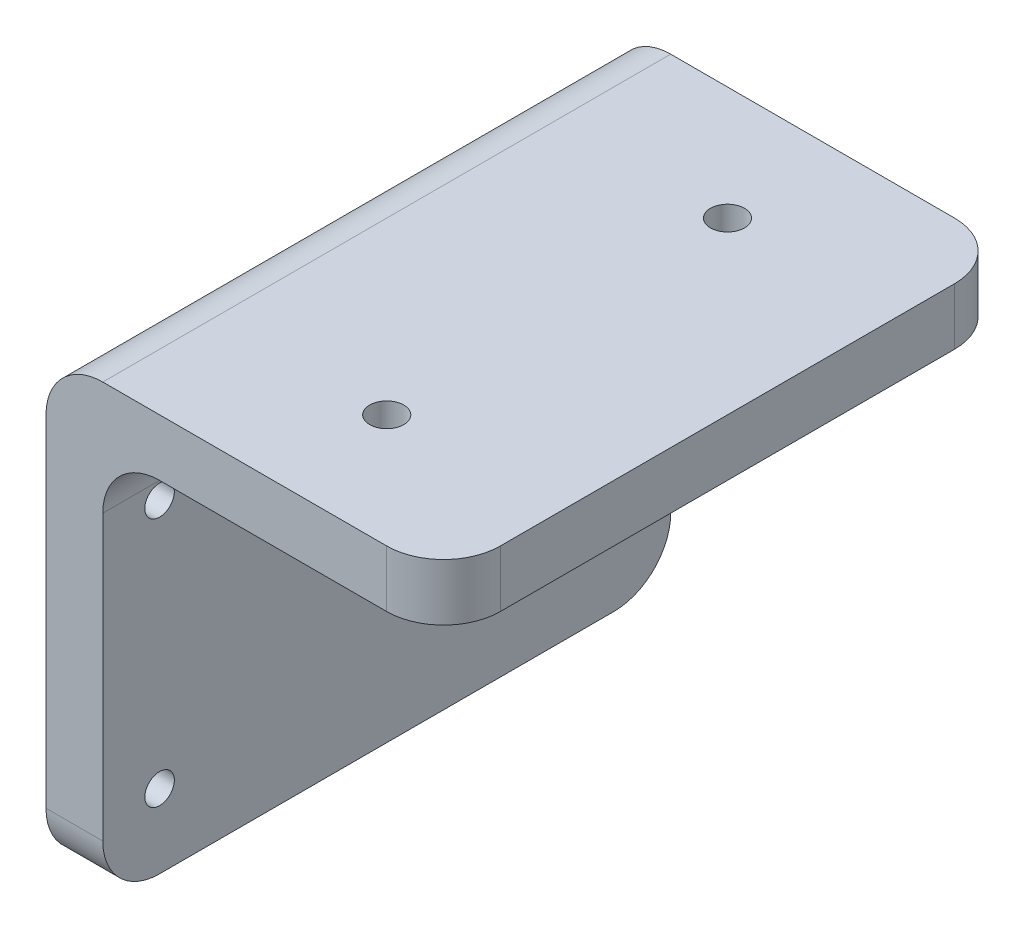
from build123d import *

# Parameters (mm, degrees)
ESQUISSE1_W             = 30
ESQUISSE1_H             = 50
BOSS_EXTRU_1_DEPTH      = 5
ESQUISSE2_W             = 50
ESQUISSE2_H             = 40
BOSS_EXTRU_2_DEPTH      = 5
CONG_2_R                = 5
ESQUISSE11_R            = 1.5
ENL_V_MAT_EXTRU_2_DEPTH = 52.23475383
ESQUISSE12_R            = 10.25
ESQUISSE12_R_2          = 1.3
ENL_V_MAT_EXTRU_3_DEPTH = 59.736700622


with BuildPart() as part:
    # Esquisse1 → Boss.-Extru.1 (new body)
    with BuildSketch(Plane(origin=(0, 0, 0), x_dir=(1, 0, 0), z_dir=(0, 1, 0))):
        Rectangle(ESQUISSE1_W, ESQUISSE1_H)
    extrude(amount=-BOSS_EXTRU_1_DEPTH)

    # Esquisse2 → Boss.-Extru.2 (add)
    with BuildSketch(Plane.ZY.offset(15)):
        with Locations((0, -20)):
            Rectangle(ESQUISSE2_W, ESQUISSE2_H)
    extrude(amount=BOSS_EXTRU_2_DEPTH)

    # Congé2
    cong_2_edges = [part.edges().sort_by_distance(p)[0] for p in [
        (-15, -5, 0),
        (-17.5, -40, 25),
        (-17.5, -40, -25),
        (-20, 0, 0),
        (15, -2.5, 25),
        (15, -2.5, -25),
    ]]
    fillet(cong_2_edges, radius=CONG_2_R)

    # Esquisse11 → Enlèv. mat.-Extru.2 (cut, through all)
    with BuildSketch(Plane(origin=(0, 0, 0), x_dir=(1, 0, 0), z_dir=(0, 1, 0))):
        with Locations(Location((0, 15, 0), (0, 0, 270))):
            Circle(ESQUISSE11_R)
        with Locations(Location((0, -15, 0), (0, 0, 270))):
            Circle(ESQUISSE11_R)
    extrude(amount=-ENL_V_MAT_EXTRU_2_DEPTH, mode=Mode.SUBTRACT)

    # Esquisse12 → Enlèv. mat.-Extru.3 (cut, through all)
    with BuildSketch(Plane.ZY.offset(20)):
        with Locations((-12, -22.5)):
            Circle(ESQUISSE12_R)
        with Locations((-20, -11.5)):
            Circle(ESQUISSE12_R_2)
        with Locations((-20, -33.5)):
            Circle(ESQUISSE12_R_2)
        with Locations((20, -33.5)):
            Circle(ESQUISSE12_R_2)
        with Locations((20, -11.5)):
            Circle(ESQUISSE12_R_2)
    extrude(amount=-ENL_V_MAT_EXTRU_3_DEPTH, mode=Mode.SUBTRACT)


solid = part.part
